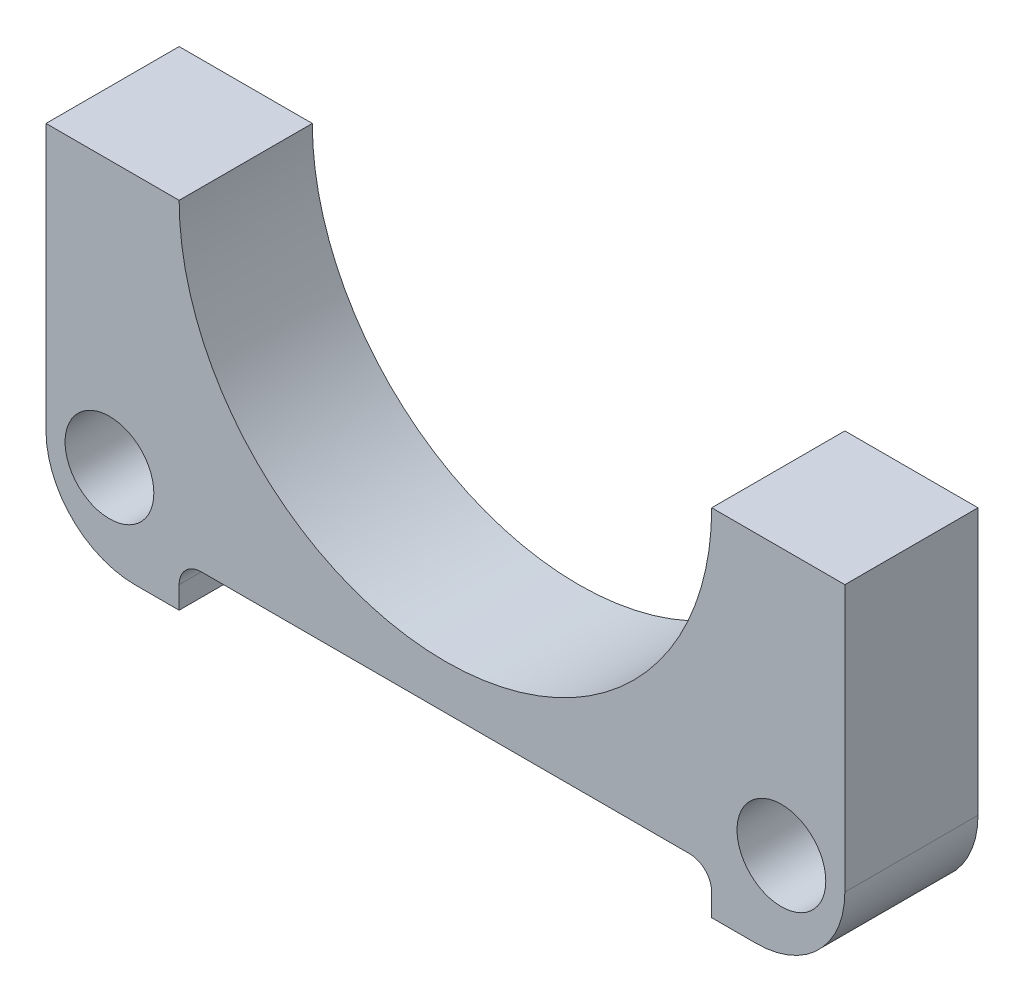
from build123d import *

# Parameters (mm, degrees)
SKETCH1_R           = 10
BOSS_EXTRUDE1_DEPTH = 15


with BuildPart() as part:
    # Sketch1 → Boss-Extrude1 (new, symmetric)
    with BuildSketch(Plane.XY):
        with BuildLine():
            Line((60, 40), (90, 40))
            Line((90, 40), (90, -20))
            ThreePointArc((90, -20), (84.142135624, -34.142135624), (70, -40))
            Line((70, -40), (60, -40))
            Line((60, -40), (60, -35))
            ThreePointArc((60, -35), (58.535533906, -31.464466094), (55, -30))
            Line((55, -30), (-55, -30))
            ThreePointArc((-55, -30), (-58.535533906, -31.464466094), (-60, -35))
            Line((-60, -35), (-60, -40))
            Line((-60, -40), (-70, -40))
            ThreePointArc((-70, -40), (-84.142135624, -34.142135624), (-90, -20))
            Line((-90, -20), (-90, 40))
            Line((-90, 40), (-60, 40))
            ThreePointArc((-60, 40), (0, -20), (60, 40))
        make_face()
        with Locations((-75.702110111, -20)):
            Circle(SKETCH1_R, mode=Mode.SUBTRACT)
        with Locations((75.7, -20)):
            Circle(SKETCH1_R, mode=Mode.SUBTRACT)
    extrude(amount=BOSS_EXTRUDE1_DEPTH, both=True)


solid = part.part
